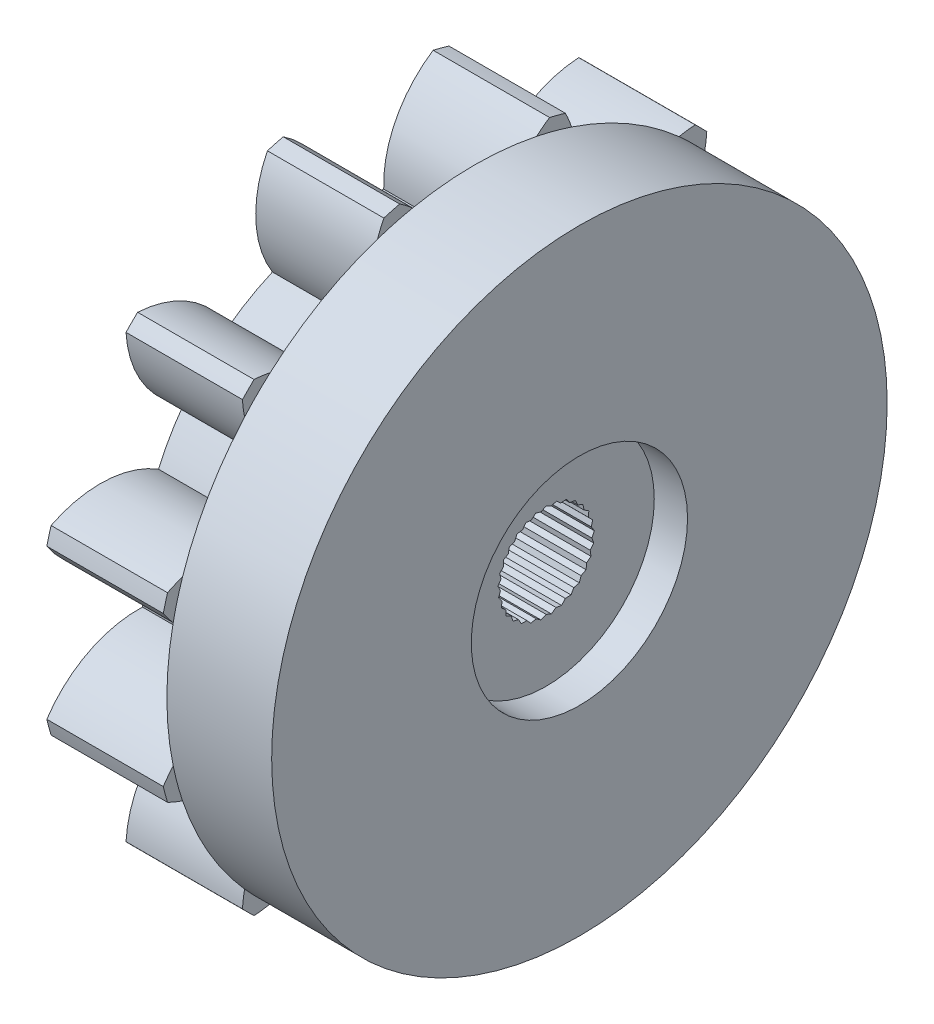
from build123d import *

# Parameters (mm, degrees)
BASPROSKE_W         = 7
BASPROSKE_H         = 19.25
TOOTHCUT_DEPTH      = 29.109162207
TEETHCUTS_COUNT     = 12
TEETHCUTS_ANGLE     = 330
BORSKE_R            = 0.4
BORE_DEPTH          = 50.0000508
EXTRUDE_START       = 6.3
SKETCH_1_R          = 18.5
SKETCH_1_R_2        = 0.4
EXTRUDE_1_DEPTH     = 6.3
SKETCH_8_R          = 6.5
SKETCH_8_R_2        = 0.4
CUT_EXTRUDE_6_DEPTH = 2
SKETCH_9_R          = 0.4
CUT_EXTRUDE_7_DEPTH = 4.4
SKETCH_10_R         = 0.9
CUT_EXTRUDE_8_DEPTH = 30.621500794


with BuildPart() as part:
    # BasProSke → Base-Revolve (revolve)
    with BuildSketch(Plane(origin=(0, 0, 0), x_dir=(1, 0, 0), z_dir=(0, 1, 0)), mode=Mode.PRIVATE) as base_revolve_sk:
        with Locations((3.5, 9.625)):
            Rectangle(BASPROSKE_W, BASPROSKE_H)
    revolve(base_revolve_sk.sketch.rotate(Axis((-10, 0, 0), (1, 0, 0)), 180), axis=Axis((-10, 0, 0), (1, 0, 0)))

    # TooCutSke → ToothCut (cut, through all)
    with BuildSketch(Plane(origin=(0, 0, 0), x_dir=(0, 0, -1), z_dir=(1, 0, 0))):
        with BuildLine():
            ThreePointArc((1.535617211, 12.970916006), (0, 13.0615), (-1.535617211, 12.970916006))
            ThreePointArc((-1.535617211, 12.970916006), (-2.27635986, 16.247221969), (-4.533719407, 18.734631928))
            ThreePointArc((-4.533719407, 18.734631928), (0, 19.2754), (4.533719407, 18.734631928))
            ThreePointArc((4.533719407, 18.734631928), (2.27635986, 16.247221969), (1.535617211, 12.970916006))
        make_face()
    toothcut = extrude(amount=TOOTHCUT_DEPTH, mode=Mode.SUBTRACT)

    # TeethCuts: ToothCut ×12 about axis
    teethcuts_axis = Axis((-10, 0, 0), (1, 0, 0))
    for i in range(1, TEETHCUTS_COUNT):
        add(toothcut.rotate(teethcuts_axis, i * TEETHCUTS_ANGLE / (TEETHCUTS_COUNT - 1)), mode=Mode.SUBTRACT)

    # BorSke → Bore (cut, symmetric)
    with BuildSketch(Plane(origin=(0, 0, 0), x_dir=(0, 0, -1), z_dir=(1, 0, 0))):
        with Locations(Location((0, 0, 0), (0, 0, 180))):
            Circle(BORSKE_R)
    extrude(amount=BORE_DEPTH, both=True, mode=Mode.SUBTRACT)

    # Эскиз1 → Бобышка-Вытянуть1 (add)
    with BuildSketch(Plane(origin=(7, 0, 0), x_dir=(0, 0, -1), z_dir=(1, 0, 0)).offset(EXTRUDE_START)):
        with Locations(Location((0, 0, 0), (0, 0, 168.366396173))):
            Circle(SKETCH_1_R)
        Circle(SKETCH_1_R_2, mode=Mode.SUBTRACT)
    extrude(amount=-EXTRUDE_1_DEPTH)

    # Эскиз8 → Вырез-Вытянуть6 (cut)
    with BuildSketch(Plane(origin=(13.3, 0, 0), x_dir=(0, 0, -1), z_dir=(1, 0, 0))):
        Circle(SKETCH_8_R)
        Circle(SKETCH_8_R_2, mode=Mode.SUBTRACT)
    extrude(amount=-CUT_EXTRUDE_6_DEPTH, mode=Mode.SUBTRACT)

    # Эскиз9 → Вырез-Вытянуть7 (cut)
    with BuildSketch(Plane(origin=(11.3, 0, 0), x_dir=(0, 0, -1), z_dir=(1, 0, 0))):
        Polygon((0.297449416, 2.735002218), (0, 2.9), (-0.297449416, 2.735002218), (-0.623414277, 2.832199612), (-0.878439845, 2.607116554), (-1.217678395, 2.631968717), (-1.418355403, 2.357325017), (-1.755005224, 2.308669891), (-1.891950238, 1.997307583), (-2.21026996, 1.877420226), (-2.277079583, 1.543898266), (-2.562184929, 1.358384478), (-2.555735218, 1.018297982), (-2.794294978, 0.775832182), (-2.714887514, 0.445083216), (-2.8957469, 0.157002835), (-2.747094688, -0.148943146), (-2.861796915, -0.46916779), (-2.650850767, -0.736005093), (-2.694032487, -1.07340065), (-2.43065601, -1.288652259), (-2.400298095, -1.62744249), (-2.09680648, -1.781043478), (-1.994328431, -2.105386927), (-1.66491261, -2.190155083), (-1.495106186, -2.484885811), (-1.155169276, -2.496857471), (-0.925974437, -2.748194196), (-0.59141151, -2.686809578), (-0.313545153, -2.883000076), (0, -2.751129456), (0.313545153, -2.883000076), (0.59141151, -2.686809578), (0.925974437, -2.748194196), (1.155169276, -2.496857471), (1.495106186, -2.484885811), (1.66491261, -2.190155083), (1.994328431, -2.105386927), (2.09680648, -1.781043478), (2.400298095, -1.62744249), (2.43065601, -1.288652259), (2.694032487, -1.07340065), (2.650850767, -0.736005093), (2.861796915, -0.46916779), (2.747094688, -0.148943146), (2.8957469, 0.157002835), (2.714887514, 0.445083216), (2.794294978, 0.775832182), (2.555735218, 1.018297982), (2.562184929, 1.358384478), (2.277079583, 1.543898266), (2.21026996, 1.877420226), (1.891950238, 1.997307583), (1.755005224, 2.308669891), (1.418355403, 2.357325017), (1.217678395, 2.631968717), (0.878439845, 2.607116554), (0.623414277, 2.832199612), align=None)
        Circle(SKETCH_9_R, mode=Mode.SUBTRACT)
    extrude(amount=-CUT_EXTRUDE_7_DEPTH, mode=Mode.SUBTRACT)

    # Эскиз10 → Вырез-Вытянуть8 (cut, through all)
    with BuildSketch(Plane.ZY):
        Circle(SKETCH_10_R)
    extrude(amount=-CUT_EXTRUDE_8_DEPTH, mode=Mode.SUBTRACT)


solid = part.part
